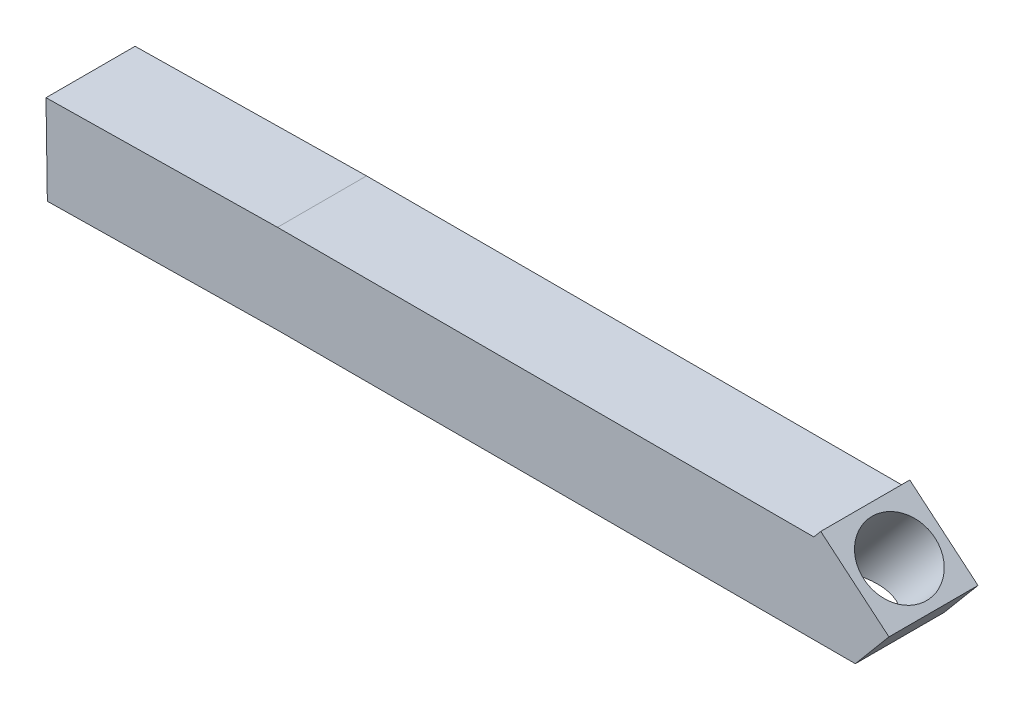
from build123d import *

# Parameters (mm, degrees)
BOSS_EXTRUDE1_DEPTH = 2.5
SKETCH2_R           = 1
CUT_EXTRUDE1_DEPTH  = 4.5
SKETCH3_R           = 1
CUT_EXTRUDE2_DEPTH  = 9.5
SKETCH5_R           = 1
BOSS_EXTRUDE2_DEPTH = 9.5
SKETCH7_W           = 2.5
SKETCH7_H           = 2.48697386
BOSS_EXTRUDE5_DEPTH = 17
SKETCH8_R           = 1
CUT_EXTRUDE3_DEPTH  = 9.5
SKETCH9_W           = 2.5
SKETCH9_H           = 2.510853282
CUT_EXTRUDE4_DEPTH  = 10.5
SKETCH10_R          = 1
CUT_EXTRUDE5_DEPTH  = 4.5
SKETCH11_R          = 1
BOSS_EXTRUDE6_DEPTH = 4.5
SKETCH12_R          = 1
CUT_EXTRUDE6_DEPTH  = 4
SKETCH13_W          = 2.5
SKETCH13_H          = 2.5
CUT_EXTRUDE7_DEPTH  = 6.5
SKETCH14_W          = 2.5
SKETCH14_H          = 2.5
BOSS_EXTRUDE7_DEPTH = 6.5
SKETCH15_R          = 1
CUT_EXTRUDE8_DEPTH  = 5


with BuildPart() as part:
    # Sketch1 → Boss-Extrude1 (new body)
    with BuildSketch(Plane.XY):
        Polygon((-70.406172668, -77.710060133), (-55.350496572, -77.710060133), (-55.155758053, -77.477979804), (-53.240646945, -79.084948828), (-54.184487309, -80.209773972), (-70.368347793, -80.209773972), align=None)
    extrude(amount=BOSS_EXTRUDE1_DEPTH)

    # Sketch2 → Cut-Extrude1 (cut)
    with BuildSketch(Plane(origin=(-60.939488189, -72.62485398, 0), x_dir=(0, 0, -1), z_dir=(0.6427876096865354, 0.7660444431189815, 0))):
        with Locations(Location((-1.25, -8.800123479, 0), (0, 0, 90))):
            Circle(SKETCH2_R)
    extrude(amount=-CUT_EXTRUDE1_DEPTH, mode=Mode.SUBTRACT)

    # Sketch3 → Cut-Extrude2 (cut)
    with BuildSketch(Plane(origin=(-71.565670343, -1.082908957, 0), x_dir=(0, 0, 1), z_dir=(-0.9998855357578962, -0.015129949839474955, 0))):
        with Locations(Location((1.25, -77.885923249, 0), (0, 0, 270))):
            Circle(SKETCH3_R)
    extrude(amount=-CUT_EXTRUDE2_DEPTH, mode=Mode.SUBTRACT)

    # Sketch5 → Boss-Extrude2 (add)
    with BuildSketch(Plane(origin=(-71.565670343, -1.082908957, 0), x_dir=(0, 0, 1), z_dir=(-0.9998855357578961, -0.015129949839476386, 0))):
        with Locations((1.25, -77.885923249)):
            Circle(SKETCH5_R)
    extrude(amount=-BOSS_EXTRUDE2_DEPTH)

    # Sketch7 → Boss-Extrude5 (add)
    with BuildSketch(Plane(origin=(-71.565670343, -1.082908957, 0), x_dir=(0, 0, 1), z_dir=(-0.9998855357578961, -0.015129949839476386, 0))):
        with Locations((1.25, -77.879410179)):
            Rectangle(SKETCH7_W, SKETCH7_H)
    extrude(amount=BOSS_EXTRUDE5_DEPTH)

    # Sketch8 → Cut-Extrude3 (cut)
    with BuildSketch(Plane(origin=(-88.56372445, -1.340118104, 0), x_dir=(0, 0, 1), z_dir=(-0.9998855357578962, -0.015129949839480206, 0))):
        with Locations(Location((1.25, -77.885923249, 0), (0, 0, 270))):
            Circle(SKETCH8_R)
    extrude(amount=-CUT_EXTRUDE3_DEPTH, mode=Mode.SUBTRACT)

    # Sketch9 → Cut-Extrude4 (cut)
    with BuildSketch(Plane(origin=(-88.56372445, -1.340118104, 0), x_dir=(0, 0, 1), z_dir=(-0.9998855357578962, -0.015129949839480206, 0))):
        with Locations((1.25, -77.89134989)):
            Rectangle(SKETCH9_W, SKETCH9_H)
    extrude(amount=-CUT_EXTRUDE4_DEPTH, mode=Mode.SUBTRACT)

    # Sketch10 → Cut-Extrude5 (cut)
    with BuildSketch(Plane(origin=(-78.064926325, -1.181253631, 0), x_dir=(0, 0, 1), z_dir=(-0.9998855357578961, -0.015129949839478678, 0))):
        with Locations(Location((1.25, -77.885923249, 0), (0, 0, 270))):
            Circle(SKETCH10_R)
    extrude(amount=-CUT_EXTRUDE5_DEPTH, mode=Mode.SUBTRACT)

    # Sketch11 → Boss-Extrude6 (add)
    with BuildSketch(Plane(origin=(-78.064926325, -1.181253631, 0), x_dir=(0, 0, 1), z_dir=(-0.9998855357578961, -0.015129949839478678, 0))):
        with Locations((1.25, -77.885923249)):
            Circle(SKETCH11_R)
    extrude(amount=-BOSS_EXTRUDE6_DEPTH)

    # Sketch12 → Cut-Extrude6 (cut)
    with BuildSketch(Plane(origin=(-78.064926325, -1.181253631, 0), x_dir=(0, 0, 1), z_dir=(-0.9998855357578961, -0.015129949839478678, 0))):
        with Locations(Location((1.25, -77.885923249, 0), (0, 0, 270))):
            Circle(SKETCH12_R)
    extrude(amount=-CUT_EXTRUDE6_DEPTH, mode=Mode.SUBTRACT)

    # Sketch13 → Cut-Extrude7 (cut)
    with BuildSketch(Plane(origin=(-78.064926325, -1.181253631, 0), x_dir=(0, 0, 1), z_dir=(-0.9998855357578961, -0.015129949839478678, 0))):
        with Locations((1.25, -77.885923249)):
            Rectangle(SKETCH13_W, SKETCH13_H)
    extrude(amount=-CUT_EXTRUDE7_DEPTH, mode=Mode.SUBTRACT)

    # Sketch14 → Boss-Extrude7 (add)
    with BuildSketch(Plane(origin=(-71.565670343, -1.082908957, 0), x_dir=(0, 0, 1), z_dir=(-0.9998855357578961, -0.015129949839476386, 0))):
        with Locations((1.25, -77.885923249)):
            Rectangle(SKETCH14_W, SKETCH14_H)
    extrude(amount=BOSS_EXTRUDE7_DEPTH)

    # Sketch15 → Cut-Extrude8 (cut)
    with BuildSketch(Plane(origin=(-78.064926325, -1.181253631, 0), x_dir=(0, 0, 1), z_dir=(-0.9998855357578961, -0.01512994983947622, 0))):
        with Locations(Location((1.25, -77.885923249, 0), (0, 0, 270))):
            Circle(SKETCH15_R)
    extrude(amount=-CUT_EXTRUDE8_DEPTH, mode=Mode.SUBTRACT)


solid = part.part
